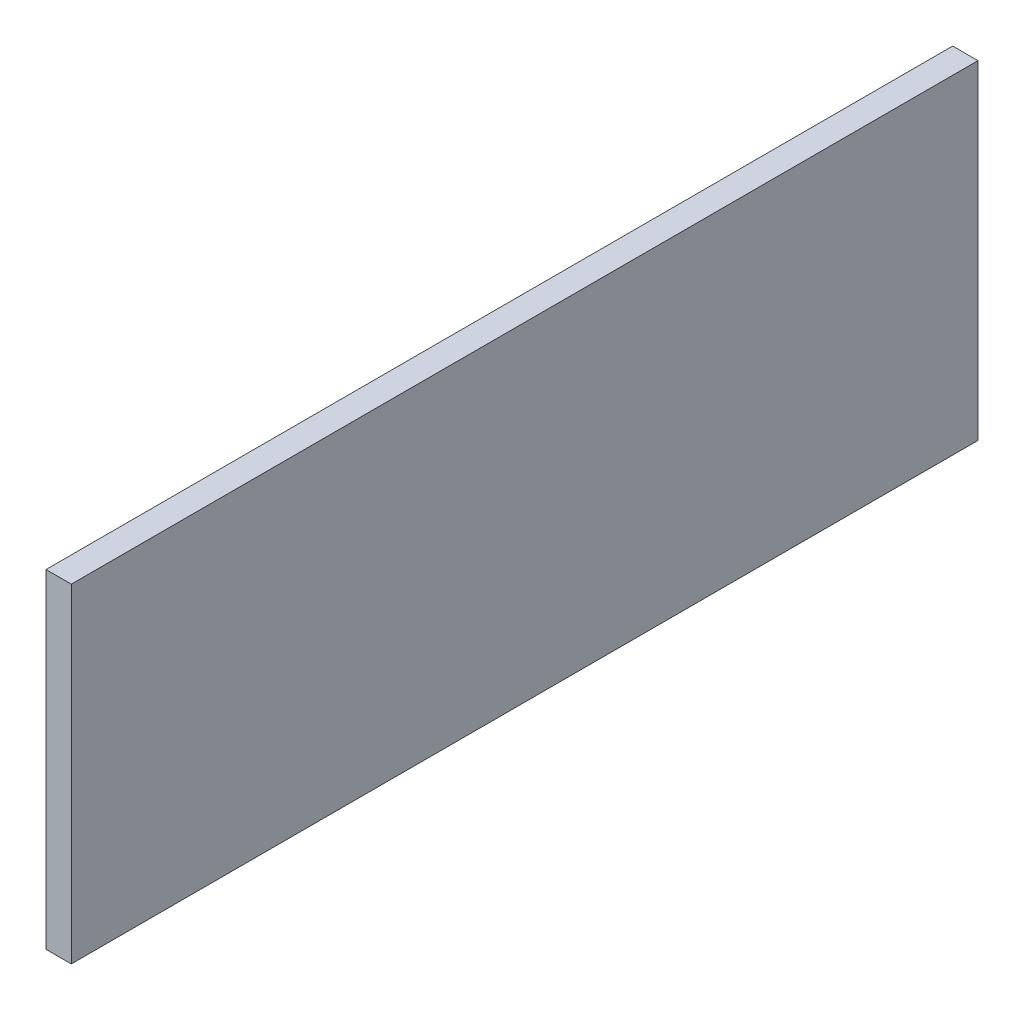
from build123d import *

# Parameters (mm, degrees)
SKETCH1_W           = 215
SKETCH1_H           = 78
BOSS_EXTRUDE1_DEPTH = 6


with BuildPart() as part:
    # Sketch1 → Boss-Extrude1 (new body)
    with BuildSketch(Plane(origin=(0, 0, 0), x_dir=(0, 0, -1), z_dir=(1, 0, 0))):
        with Locations((43.701076401, 0.304935635)):
            Rectangle(SKETCH1_W, SKETCH1_H)
    extrude(amount=BOSS_EXTRUDE1_DEPTH)


solid = part.part
